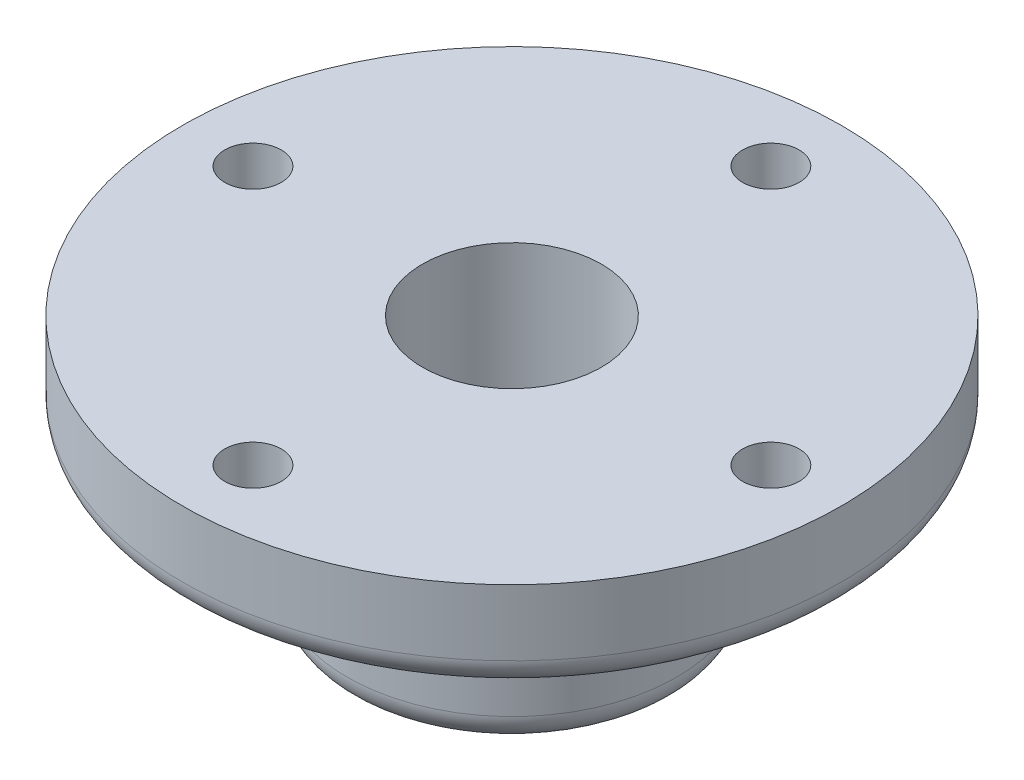
from build123d import *

# Parameters (mm, degrees)
CORTAR_EXTRUIR1_REACH = 107
CROQUIS2_R            = 6
MATRIZC1_COUNT        = 4
REDONDEO1_R           = 6


with BuildPart() as part:
    # Croquis1 → Revolución1 (revolve)
    with BuildSketch(Plane.XY, mode=Mode.PRIVATE) as revoluci_n1_sk:
        Polygon((70, 69.296099235), (70, 49.296099235), (35, 49.296099235), (35, 14.296099235), (19, 14.296099235), (19, 69.296099235), align=None)
    revolve(revoluci_n1_sk.sketch.rotate(Axis((0, 0, 0), (0, 1, 0)), 90), axis=Axis((0, 0, 0), (0, 1, 0)))

    # Croquis2 → Cortar-Extruir1 (cut, up to next)
    with BuildSketch(Plane.XZ.offset(-49.296099235), mode=Mode.PRIVATE) as cortar_extruir1_sk1:
        with Locations(Location((0, 55, 0), (0, 0, 270))):
            Circle(CROQUIS2_R)
    cortar_extruir1_tool1 = extrude(cortar_extruir1_sk1.sketch, amount=-CORTAR_EXTRUIR1_REACH, mode=Mode.PRIVATE) & part.part
    cortar_extruir1 = cortar_extruir1_tool1.solids().sort_by_distance((0, 49.296099, 55))[0]
    add(cortar_extruir1, mode=Mode.SUBTRACT)

    # MatrizC1: Cortar-Extruir1 ×4 about axis
    matrizc1_axis = Axis((0, 0, 0), (0, 1, 0))
    for i in range(1, MATRIZC1_COUNT):
        add(cortar_extruir1.rotate(matrizc1_axis, i * 360 / MATRIZC1_COUNT), mode=Mode.SUBTRACT)

    # Redondeo1
    redondeo1_edges = [part.edges().sort_by_distance(p)[0] for p in [
        (0, 14.296099235, 35),
        (0, 49.296099235, 35),
        (0, 49.296099235, 70),
    ]]
    fillet(redondeo1_edges, radius=REDONDEO1_R)


solid = part.part
